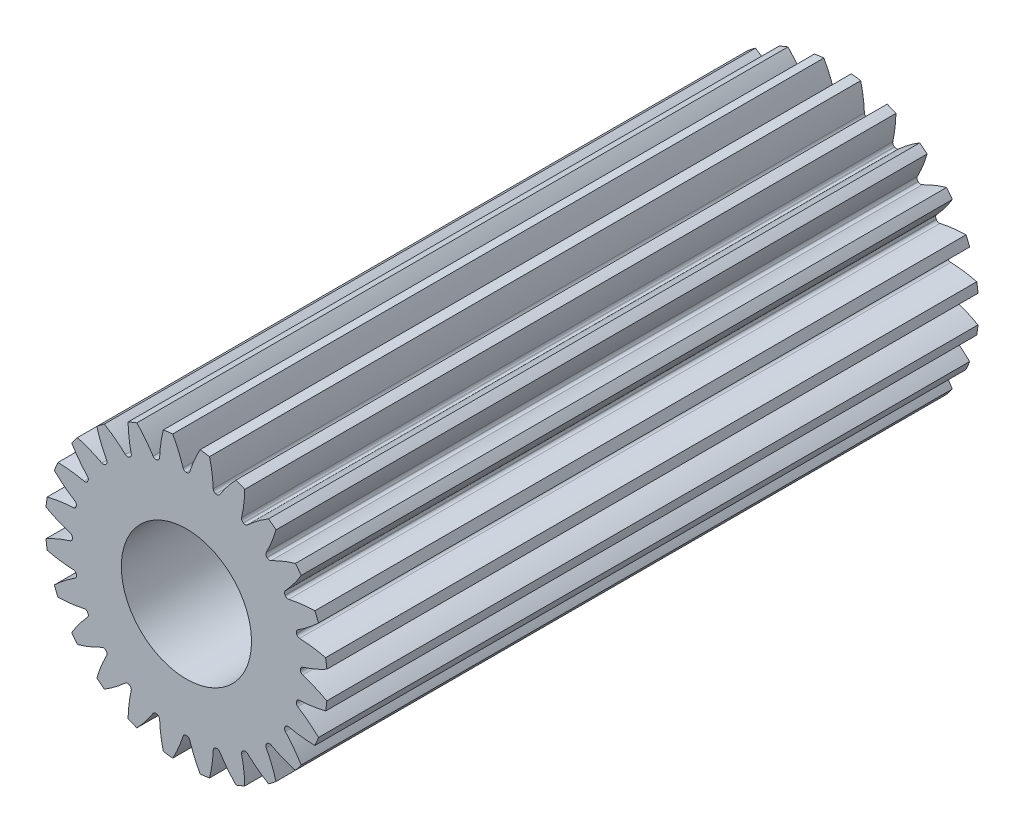
from build123d import *
from build123d.topology import SkipClean

# Parameters (mm, degrees)
CUT_EXTRUDE2_DEPTH  = 10.669539803
CIRPATTERN1_COUNT   = 24
BOSS_EXTRUDE1_START = 27
BOSS_EXTRUDE1_DEPTH = 27
CUT_EXTRUDE3_DEPTH  = 10
SKETCH10_R          = 3
CUT_EXTRUDE4_DEPTH  = 10


with BuildPart() as part:
    # Sketch4 → Revolve1 (revolve)
    with BuildSketch(Plane(origin=(0, 0, 0), x_dir=(0, 0, -1), z_dir=(1, 0, 0))):
        Polygon((-3, 4), (-3, 6.5), (0, 6.5), (0, 2), (0, 0), (-3, 0), (-3, 2), align=None)
    revolve(axis=Axis((0, 0, 3), (0, 0, 1)))

    # Sketch7 → Cut-Extrude2 (cut, through all)
    with BuildSketch(Plane.XY.offset(3)):
        with BuildLine():
            ThreePointArc((-0.012291339, 5.249985612), (0, 5.25), (0.012291339, 5.249985612))
            ThreePointArc((0.012291339, 5.249985612), (0.10141019, 5.279068119), (0.155863571, 5.355375334))
            ThreePointArc((0.155863571, 5.355375334), (0.365213913, 5.92435749), (0.630915262, 6.469307995))
            ThreePointArc((0.630915262, 6.469307995), (0, 6.5), (-0.630915262, 6.469307995))
            ThreePointArc((-0.630915262, 6.469307995), (-0.365213913, 5.92435749), (-0.155863571, 5.355375334))
            ThreePointArc((-0.155863571, 5.355375334), (-0.10141019, 5.279068119), (-0.012291339, 5.249985612))
        make_face()
    cut_extrude2 = extrude(amount=-CUT_EXTRUDE2_DEPTH, mode=Mode.SUBTRACT)

    # CirPattern1: Cut-Extrude2 ×24 about axis
    cirpattern1_axis = Axis((0, 0, 0), (0, 0, 1))
    for i in range(1, CIRPATTERN1_COUNT):
        add(cut_extrude2.rotate(cirpattern1_axis, i * 360 / CIRPATTERN1_COUNT), mode=Mode.SUBTRACT)

    # Sketch8 → Boss-Extrude1 (add)
    with SkipClean():  # the faces are left unmerged after this step: merging them gives an invalid solid
        with BuildSketch(Plane.XY.offset(3).offset(BOSS_EXTRUDE1_START)):
            with BuildLine():
                ThreePointArc((-1.536625779, 5.132554884), (-1.886106099, 5.627965588), (-2.283797464, 6.085578785))
                ThreePointArc((-2.283797464, 6.085578785), (-2.48744231, 6.005216961), (-2.688265353, 5.918042699))
                ThreePointArc((-2.688265353, 5.918042699), (-2.645894219, 5.313251044), (-2.542705855, 4.715822871))
                ThreePointArc((-2.542705855, 4.715822871), (-2.551710259, 4.622512194), (-2.614348194, 4.552766579))
                ThreePointArc((-2.614348194, 4.552766579), (-2.625, 4.54663337), (-2.635637418, 4.54047524))
                ThreePointArc((-2.635637418, 4.54047524), (-2.72735786, 4.521102004), (-2.812669479, 4.559959301))
                ThreePointArc((-2.812669479, 4.559959301), (-3.278463271, 4.948037131), (-3.781042642, 5.287127437))
                ThreePointArc((-3.781042642, 5.287127437), (-3.956949289, 5.156796712), (-4.128367093, 5.020616013))
                ThreePointArc((-4.128367093, 5.020616013), (-3.930908121, 4.44739859), (-3.676610026, 3.897034402))
                ThreePointArc((-3.676610026, 3.897034402), (-3.661157032, 3.804572698), (-3.703609138, 3.720991716))
                ThreePointArc((-3.703609138, 3.720991716), (-3.712310601, 3.712310601), (-3.720991716, 3.703609138))
                ThreePointArc((-3.720991716, 3.703609138), (-3.804572698, 3.661157032), (-3.897034402, 3.676610026))
                ThreePointArc((-3.897034402, 3.676610026), (-4.44739859, 3.930908121), (-5.020616013, 4.128367093))
                ThreePointArc((-5.020616013, 4.128367093), (-5.156796712, 3.956949289), (-5.287127437, 3.781042642))
                ThreePointArc((-5.287127437, 3.781042642), (-4.948037131, 3.278463271), (-4.559959301, 2.812669479))
                ThreePointArc((-4.559959301, 2.812669479), (-4.521102004, 2.72735786), (-4.54047524, 2.635637418))
                ThreePointArc((-4.54047524, 2.635637418), (-4.54663337, 2.625), (-4.552766579, 2.614348194))
                ThreePointArc((-4.552766579, 2.614348194), (-4.622512194, 2.551710259), (-4.715822871, 2.542705855))
                ThreePointArc((-4.715822871, 2.542705855), (-5.313251044, 2.645894219), (-5.918042699, 2.688265353))
                ThreePointArc((-5.918042699, 2.688265353), (-6.005216961, 2.48744231), (-6.085578785, 2.283797464))
                ThreePointArc((-6.085578785, 2.283797464), (-5.627965588, 1.886106099), (-5.132554884, 1.536625779))
                ThreePointArc((-5.132554884, 1.536625779), (-5.072941346, 1.464278091), (-5.067915457, 1.370668785))
                ThreePointArc((-5.067915457, 1.370668785), (-5.071110588, 1.358799987), (-5.074277923, 1.346923741))
                ThreePointArc((-5.074277923, 1.346923741), (-5.125435123, 1.268368648), (-5.213235805, 1.235520482))
                ThreePointArc((-5.213235805, 1.235520482), (-5.81701422, 1.180566998), (-6.412164556, 1.064962772))
                ThreePointArc((-6.412164556, 1.064962772), (-6.444391599, 0.848420249), (-6.469307995, 0.630915262))
                ThreePointArc((-6.469307995, 0.630915262), (-5.92435749, 0.365213913), (-5.355375334, 0.155863571))
                ThreePointArc((-5.355375334, 0.155863571), (-5.279068119, 0.10141019), (-5.249985612, 0.012291339))
                ThreePointArc((-5.249985612, 0.012291339), (-5.25, 0), (-5.249985612, -0.012291339))
                ThreePointArc((-5.249985612, -0.012291339), (-5.279068119, -0.10141019), (-5.355375334, -0.155863571))
                ThreePointArc((-5.355375334, -0.155863571), (-5.92435749, -0.365213913), (-6.469307995, -0.630915262))
                ThreePointArc((-6.469307995, -0.630915262), (-6.444391599, -0.848420249), (-6.412164556, -1.064962772))
                ThreePointArc((-6.412164556, -1.064962772), (-5.81701422, -1.180566998), (-5.213235805, -1.235520482))
                ThreePointArc((-5.213235805, -1.235520482), (-5.125435123, -1.268368648), (-5.074277923, -1.346923741))
                ThreePointArc((-5.074277923, -1.346923741), (-5.071110588, -1.358799987), (-5.067915457, -1.370668785))
                ThreePointArc((-5.067915457, -1.370668785), (-5.072941346, -1.464278091), (-5.132554884, -1.536625779))
                ThreePointArc((-5.132554884, -1.536625779), (-5.627965588, -1.886106099), (-6.085578785, -2.283797464))
                ThreePointArc((-6.085578785, -2.283797464), (-6.005216961, -2.48744231), (-5.918042699, -2.688265353))
                ThreePointArc((-5.918042699, -2.688265353), (-5.313251044, -2.645894219), (-4.715822871, -2.542705855))
                ThreePointArc((-4.715822871, -2.542705855), (-4.622512194, -2.551710259), (-4.552766579, -2.614348194))
                ThreePointArc((-4.552766579, -2.614348194), (-4.54663337, -2.625), (-4.54047524, -2.635637418))
                ThreePointArc((-4.54047524, -2.635637418), (-4.521102004, -2.72735786), (-4.559959301, -2.812669479))
                ThreePointArc((-4.559959301, -2.812669479), (-4.948037131, -3.278463271), (-5.287127437, -3.781042642))
                ThreePointArc((-5.287127437, -3.781042642), (-5.156796712, -3.956949289), (-5.020616013, -4.128367093))
                ThreePointArc((-5.020616013, -4.128367093), (-4.44739859, -3.930908121), (-3.897034402, -3.676610026))
                ThreePointArc((-3.897034402, -3.676610026), (-3.804572698, -3.661157032), (-3.720991716, -3.703609138))
                ThreePointArc((-3.720991716, -3.703609138), (-3.712310601, -3.712310601), (-3.703609138, -3.720991716))
                ThreePointArc((-3.703609138, -3.720991716), (-3.661157032, -3.804572698), (-3.676610026, -3.897034402))
                ThreePointArc((-3.676610026, -3.897034402), (-3.930908121, -4.44739859), (-4.128367093, -5.020616013))
                ThreePointArc((-4.128367093, -5.020616013), (-3.956949289, -5.156796712), (-3.781042642, -5.287127437))
                ThreePointArc((-3.781042642, -5.287127437), (-3.278463271, -4.948037131), (-2.812669479, -4.559959301))
                ThreePointArc((-2.812669479, -4.559959301), (-2.72735786, -4.521102004), (-2.635637418, -4.54047524))
                ThreePointArc((-2.635637418, -4.54047524), (-2.625, -4.54663337), (-2.614348194, -4.552766579))
                ThreePointArc((-2.614348194, -4.552766579), (-2.551710259, -4.622512194), (-2.542705855, -4.715822871))
                ThreePointArc((-2.542705855, -4.715822871), (-2.645894219, -5.313251044), (-2.688265353, -5.918042699))
                ThreePointArc((-2.688265353, -5.918042699), (-2.48744231, -6.005216961), (-2.283797464, -6.085578785))
                ThreePointArc((-2.283797464, -6.085578785), (-1.886106099, -5.627965588), (-1.536625779, -5.132554884))
                ThreePointArc((-1.536625779, -5.132554884), (-1.464278091, -5.072941346), (-1.370668785, -5.067915457))
                ThreePointArc((-1.370668785, -5.067915457), (-1.358799987, -5.071110588), (-1.346923741, -5.074277923))
                ThreePointArc((-1.346923741, -5.074277923), (-1.268368648, -5.125435123), (-1.235520482, -5.213235805))
                ThreePointArc((-1.235520482, -5.213235805), (-1.180566998, -5.81701422), (-1.064962772, -6.412164556))
                ThreePointArc((-1.064962772, -6.412164556), (-0.848420249, -6.444391599), (-0.630915262, -6.469307995))
                ThreePointArc((-0.630915262, -6.469307995), (-0.365213913, -5.92435749), (-0.155863571, -5.355375334))
                ThreePointArc((-0.155863571, -5.355375334), (-0.10141019, -5.279068119), (-0.012291339, -5.249985612))
                ThreePointArc((-0.012291339, -5.249985612), (0, -5.25), (0.012291339, -5.249985612))
                ThreePointArc((0.012291339, -5.249985612), (0.10141019, -5.279068119), (0.155863571, -5.355375334))
                ThreePointArc((0.155863571, -5.355375334), (0.365213913, -5.92435749), (0.630915262, -6.469307995))
                ThreePointArc((0.630915262, -6.469307995), (0.848420249, -6.444391599), (1.064962772, -6.412164556))
                ThreePointArc((1.064962772, -6.412164556), (1.180566998, -5.81701422), (1.235520482, -5.213235805))
                ThreePointArc((1.235520482, -5.213235805), (1.268368648, -5.125435123), (1.346923741, -5.074277923))
                ThreePointArc((1.346923741, -5.074277923), (1.358799987, -5.071110588), (1.370668785, -5.067915457))
                ThreePointArc((1.370668785, -5.067915457), (1.464278091, -5.072941346), (1.536625779, -5.132554884))
                ThreePointArc((1.536625779, -5.132554884), (1.886106099, -5.627965588), (2.283797464, -6.085578785))
                ThreePointArc((2.283797464, -6.085578785), (2.48744231, -6.005216961), (2.688265353, -5.918042699))
                ThreePointArc((2.688265353, -5.918042699), (2.645894219, -5.313251044), (2.542705855, -4.715822871))
                ThreePointArc((2.542705855, -4.715822871), (2.551710259, -4.622512194), (2.614348194, -4.552766579))
                ThreePointArc((2.614348194, -4.552766579), (2.625, -4.54663337), (2.635637418, -4.54047524))
                ThreePointArc((2.635637418, -4.54047524), (2.72735786, -4.521102004), (2.812669479, -4.559959301))
                ThreePointArc((2.812669479, -4.559959301), (3.278463271, -4.948037131), (3.781042642, -5.287127437))
                ThreePointArc((3.781042642, -5.287127437), (3.956949289, -5.156796712), (4.128367093, -5.020616013))
                ThreePointArc((4.128367093, -5.020616013), (3.930908121, -4.44739859), (3.676610026, -3.897034402))
                ThreePointArc((3.676610026, -3.897034402), (3.661157032, -3.804572698), (3.703609138, -3.720991716))
                ThreePointArc((3.703609138, -3.720991716), (3.712310601, -3.712310601), (3.720991716, -3.703609138))
                ThreePointArc((3.720991716, -3.703609138), (3.804572698, -3.661157032), (3.897034402, -3.676610026))
                ThreePointArc((3.897034402, -3.676610026), (4.44739859, -3.930908121), (5.020616013, -4.128367093))
                ThreePointArc((5.020616013, -4.128367093), (5.156796712, -3.956949289), (5.287127437, -3.781042642))
                ThreePointArc((5.287127437, -3.781042642), (4.948037131, -3.278463271), (4.559959301, -2.812669479))
                ThreePointArc((4.559959301, -2.812669479), (4.521102004, -2.72735786), (4.54047524, -2.635637418))
                ThreePointArc((4.54047524, -2.635637418), (4.54663337, -2.625), (4.552766579, -2.614348194))
                ThreePointArc((4.552766579, -2.614348194), (4.622512194, -2.551710259), (4.715822871, -2.542705855))
                ThreePointArc((4.715822871, -2.542705855), (5.313251044, -2.645894219), (5.918042699, -2.688265353))
                ThreePointArc((5.918042699, -2.688265353), (6.005216961, -2.48744231), (6.085578785, -2.283797464))
                ThreePointArc((6.085578785, -2.283797464), (5.627965588, -1.886106099), (5.132554884, -1.536625779))
                ThreePointArc((5.132554884, -1.536625779), (5.072941346, -1.464278091), (5.067915457, -1.370668785))
                ThreePointArc((5.067915457, -1.370668785), (5.071110588, -1.358799987), (5.074277923, -1.346923741))
                ThreePointArc((5.074277923, -1.346923741), (5.125435123, -1.268368648), (5.213235805, -1.235520482))
                ThreePointArc((5.213235805, -1.235520482), (5.81701422, -1.180566998), (6.412164556, -1.064962772))
                ThreePointArc((6.412164556, -1.064962772), (6.444391599, -0.848420249), (6.469307995, -0.630915262))
                ThreePointArc((6.469307995, -0.630915262), (5.92435749, -0.365213913), (5.355375334, -0.155863571))
                ThreePointArc((5.355375334, -0.155863571), (5.279068119, -0.10141019), (5.249985612, -0.012291339))
                ThreePointArc((5.249985612, -0.012291339), (5.25, 0), (5.249985612, 0.012291339))
                ThreePointArc((5.249985612, 0.012291339), (5.279068119, 0.10141019), (5.355375334, 0.155863571))
                ThreePointArc((5.355375334, 0.155863571), (5.92435749, 0.365213913), (6.469307995, 0.630915262))
                ThreePointArc((6.469307995, 0.630915262), (6.444391599, 0.848420249), (6.412164556, 1.064962772))
                ThreePointArc((6.412164556, 1.064962772), (5.81701422, 1.180566998), (5.213235805, 1.235520482))
                ThreePointArc((5.213235805, 1.235520482), (5.125435123, 1.268368648), (5.074277923, 1.346923741))
                ThreePointArc((5.074277923, 1.346923741), (5.071110588, 1.358799987), (5.067915457, 1.370668785))
                ThreePointArc((5.067915457, 1.370668785), (5.072941346, 1.464278091), (5.132554884, 1.536625779))
                ThreePointArc((5.132554884, 1.536625779), (5.627965588, 1.886106099), (6.085578785, 2.283797464))
                ThreePointArc((6.085578785, 2.283797464), (6.005216961, 2.48744231), (5.918042699, 2.688265353))
                ThreePointArc((5.918042699, 2.688265353), (5.313251044, 2.645894219), (4.715822871, 2.542705855))
                ThreePointArc((4.715822871, 2.542705855), (4.622512194, 2.551710259), (4.552766579, 2.614348194))
                ThreePointArc((4.552766579, 2.614348194), (4.54663337, 2.625), (4.54047524, 2.635637418))
                ThreePointArc((4.54047524, 2.635637418), (4.521102004, 2.72735786), (4.559959301, 2.812669479))
                ThreePointArc((4.559959301, 2.812669479), (4.948037131, 3.278463271), (5.287127437, 3.781042642))
                ThreePointArc((5.287127437, 3.781042642), (5.156796712, 3.956949289), (5.020616013, 4.128367093))
                ThreePointArc((5.020616013, 4.128367093), (4.44739859, 3.930908121), (3.897034402, 3.676610026))
                ThreePointArc((3.897034402, 3.676610026), (3.804572698, 3.661157032), (3.720991716, 3.703609138))
                ThreePointArc((3.720991716, 3.703609138), (3.712310601, 3.712310601), (3.703609138, 3.720991716))
                ThreePointArc((3.703609138, 3.720991716), (3.661157032, 3.804572698), (3.676610026, 3.897034402))
                ThreePointArc((3.676610026, 3.897034402), (3.930908121, 4.44739859), (4.128367093, 5.020616013))
                ThreePointArc((4.128367093, 5.020616013), (3.956949289, 5.156796712), (3.781042642, 5.287127437))
                ThreePointArc((3.781042642, 5.287127437), (3.278463271, 4.948037131), (2.812669479, 4.559959301))
                ThreePointArc((2.812669479, 4.559959301), (2.72735786, 4.521102004), (2.635637418, 4.54047524))
                ThreePointArc((2.635637418, 4.54047524), (2.625, 4.54663337), (2.614348194, 4.552766579))
                ThreePointArc((2.614348194, 4.552766579), (2.551710259, 4.622512194), (2.542705855, 4.715822871))
                ThreePointArc((2.542705855, 4.715822871), (2.645894219, 5.313251044), (2.688265353, 5.918042699))
                ThreePointArc((2.688265353, 5.918042699), (2.48744231, 6.005216961), (2.283797464, 6.085578785))
                ThreePointArc((2.283797464, 6.085578785), (1.886106099, 5.627965588), (1.536625779, 5.132554884))
                ThreePointArc((1.536625779, 5.132554884), (1.464278091, 5.072941346), (1.370668785, 5.067915457))
                ThreePointArc((1.370668785, 5.067915457), (1.358799987, 5.071110588), (1.346923741, 5.074277923))
                ThreePointArc((1.346923741, 5.074277923), (1.268368648, 5.125435123), (1.235520482, 5.213235805))
                ThreePointArc((1.235520482, 5.213235805), (1.180566998, 5.81701422), (1.064962772, 6.412164556))
                ThreePointArc((1.064962772, 6.412164556), (0.848420249, 6.444391599), (0.630915262, 6.469307995))
                ThreePointArc((0.630915262, 6.469307995), (0.365213913, 5.92435749), (0.155863571, 5.355375334))
                ThreePointArc((0.155863571, 5.355375334), (0.10141019, 5.279068119), (0.012291339, 5.249985612))
                ThreePointArc((0.012291339, 5.249985612), (0, 5.25), (-0.012291339, 5.249985612))
                ThreePointArc((-0.012291339, 5.249985612), (-0.10141019, 5.279068119), (-0.155863571, 5.355375334))
                ThreePointArc((-0.155863571, 5.355375334), (-0.365213913, 5.92435749), (-0.630915262, 6.469307995))
                ThreePointArc((-0.630915262, 6.469307995), (-0.848420249, 6.444391599), (-1.064962772, 6.412164556))
                ThreePointArc((-1.064962772, 6.412164556), (-1.180566998, 5.81701422), (-1.235520482, 5.213235805))
                ThreePointArc((-1.235520482, 5.213235805), (-1.268368648, 5.125435123), (-1.346923741, 5.074277923))
                ThreePointArc((-1.346923741, 5.074277923), (-1.358799987, 5.071110588), (-1.370668785, 5.067915457))
                ThreePointArc((-1.370668785, 5.067915457), (-1.464278091, 5.072941346), (-1.536625779, 5.132554884))
            make_face()
        extrude(amount=-BOSS_EXTRUDE1_DEPTH)

    # Sketch9 → Cut-Extrude3 (cut)
    with SkipClean():  # the faces are left unmerged after this step: merging them gives an invalid solid
        with BuildSketch(Plane(origin=(0, 0, 0), x_dir=(-1, 0, 0), z_dir=(0, 0, -1))):
            with BuildLine():
                Line((-1.428285686, 1.4), (1.428285686, 1.4))
                ThreePointArc((1.428285686, 1.4), (0, -2), (-1.428285686, 1.4))
            make_face()
        extrude(amount=-CUT_EXTRUDE3_DEPTH, mode=Mode.SUBTRACT)

    # Sketch10 → Cut-Extrude4 (cut)
    with SkipClean():  # the faces are left unmerged after this step: merging them gives an invalid solid
        with BuildSketch(Plane.XY.offset(30)):
            Circle(SKETCH10_R)
        extrude(amount=-CUT_EXTRUDE4_DEPTH, mode=Mode.SUBTRACT)


solid = part.part
